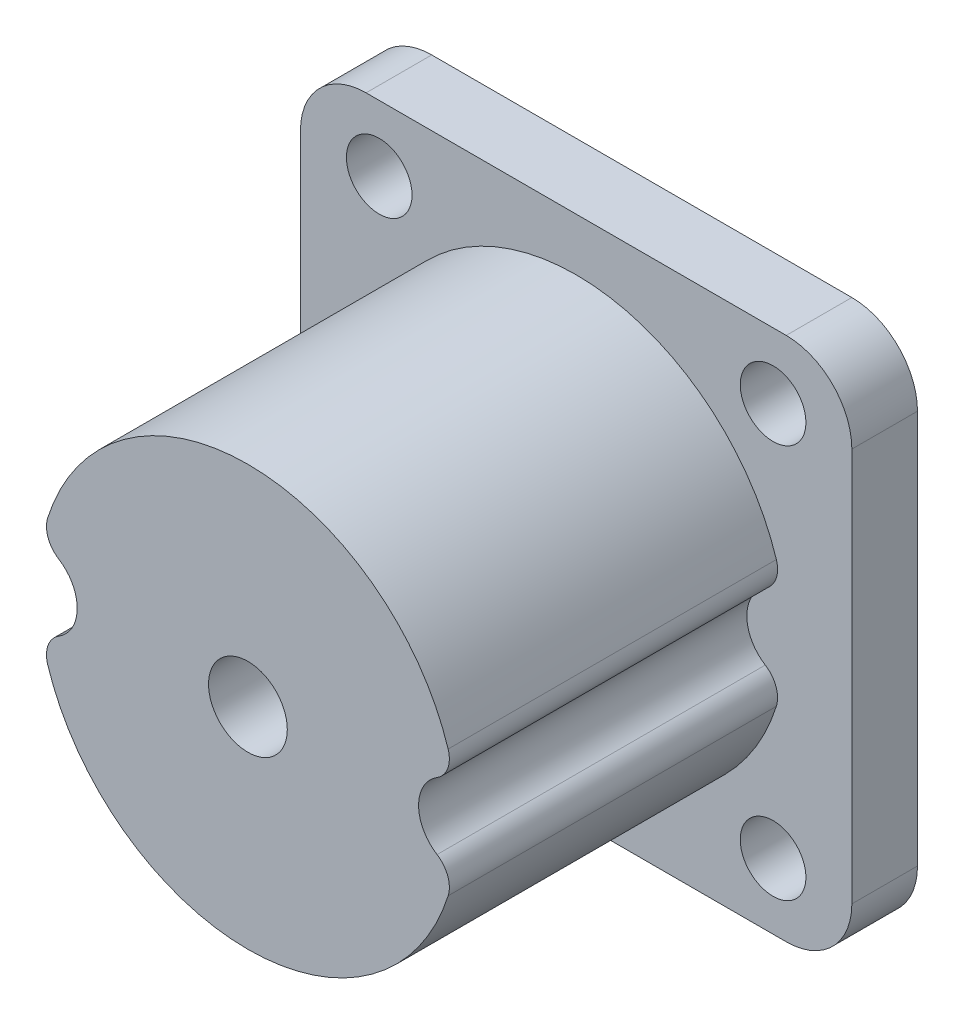
from build123d import *

# Parameters (mm, degrees)
SKETCH1_W           = 42
SKETCH1_H           = 40
SKETCH1_R           = 3
SKETCH1_R_2         = 2.5
BOSS_EXTRUDE1_DEPTH = 5
FILLET1_R           = 5
SKETCH2_R           = 3
BOSS_EXTRUDE2_DEPTH = 25
FILLET2_R           = 2


with BuildPart() as part:
    # Sketch1 → Boss-Extrude1 (new body)
    with BuildSketch(Plane.XY):
        Rectangle(SKETCH1_W, SKETCH1_H)
        Circle(SKETCH1_R, mode=Mode.SUBTRACT)
        with Locations((-15, 15)):
            Circle(SKETCH1_R_2, mode=Mode.SUBTRACT)
        with Locations((15, 15)):
            Circle(SKETCH1_R_2, mode=Mode.SUBTRACT)
        with Locations(Location((15, -15, 0), (0, 0, 180))):
            Circle(SKETCH1_R_2, mode=Mode.SUBTRACT)
        with Locations(Location((-15, -15, 0), (0, 0, 180))):
            Circle(SKETCH1_R_2, mode=Mode.SUBTRACT)
    extrude(amount=BOSS_EXTRUDE1_DEPTH)

    # Fillet1
    fillet1_edges = [part.edges().sort_by_distance(p)[0] for p in [
        (21, -20, 2.5),
        (-21, -20, 2.5),
        (-21, 20, 2.5),
        (21, 20, 2.5),
    ]]
    fillet(fillet1_edges, radius=FILLET1_R)

    # Sketch2 → Boss-Extrude2 (add)
    with BuildSketch(Plane.XY.offset(5)):
        with BuildLine():
            ThreePointArc((-15.71875, -2.98678731), (0, -16), (15.71875, -2.98678731))
            ThreePointArc((15.71875, -2.98678731), (13, 0), (15.71875, 2.98678731))
            ThreePointArc((15.71875, 2.98678731), (0, 16), (-15.71875, 2.98678731))
            ThreePointArc((-15.71875, 2.98678731), (-13, 0), (-15.71875, -2.98678731))
        make_face()
        Circle(SKETCH2_R, mode=Mode.SUBTRACT)
    extrude(amount=BOSS_EXTRUDE2_DEPTH)

    # Fillet2
    fillet2_edges = [part.edges().sort_by_distance(p)[0] for p in [
        (15.71875, -2.98678731, 17.5),
        (15.71875, 2.98678731, 17.5),
        (-15.71875, 2.98678731, 17.5),
        (-15.71875, -2.98678731, 17.5),
    ]]
    fillet(fillet2_edges, radius=FILLET2_R)


solid = part.part
